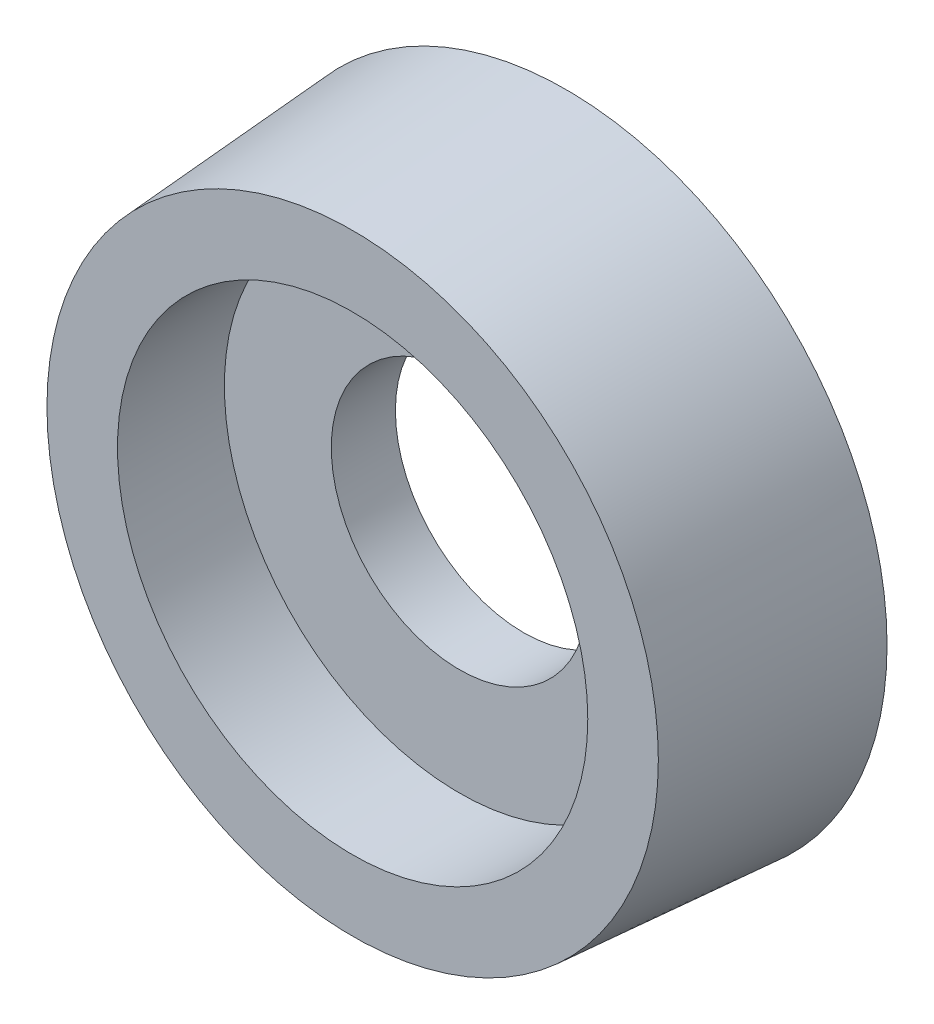
from build123d import *

# Parameters (mm, degrees)
SKETCH_1_R               = 7.5
EXTRUDE_1_DEPTH          = 5
EXTRUDE_1_TAPER          = 4
SKETCH_3_R               = 5
CUT_EXTRUDE_1_DEPTH      = 1
SKETCH_4_R               = 5.5
CUT_EXTRUDE_2_DEPTH      = 2.5
CUT_EXTRUDE_3_DEPTH      = 11.897247359
CUT_EXTRUDE_3_DEPTH_BACK = 11.897247359
SKETCH_5_R               = 3


with BuildPart() as part:
    # Эскиз1 → Бобышка-Вытянуть1 (new body)
    with BuildSketch(Plane.XY):
        Circle(SKETCH_1_R)
    extrude(amount=EXTRUDE_1_DEPTH, taper=EXTRUDE_1_TAPER)

    # Эскиз3 → Вырез-Вытянуть1 (cut)
    with BuildSketch(Plane(origin=(0, 0, 0), x_dir=(-1, 0, 0), z_dir=(0, 0, -1))):
        Circle(SKETCH_3_R)
    extrude(amount=-CUT_EXTRUDE_1_DEPTH, mode=Mode.SUBTRACT)

    # Эскиз4 → Вырез-Вытянуть2 (cut)
    with BuildSketch(Plane.XY.offset(5)):
        Circle(SKETCH_4_R)
    extrude(amount=-CUT_EXTRUDE_2_DEPTH, mode=Mode.SUBTRACT)

    # Эскиз5 → Вырез-Вытянуть3 (cut, two sides: drawn at the far end of the back side and taken through both)
    with BuildSketch(Plane.XY.offset(2.5).offset(-CUT_EXTRUDE_3_DEPTH_BACK)):
        Circle(SKETCH_5_R)
    extrude(amount=CUT_EXTRUDE_3_DEPTH + CUT_EXTRUDE_3_DEPTH_BACK, mode=Mode.SUBTRACT)


solid = part.part
